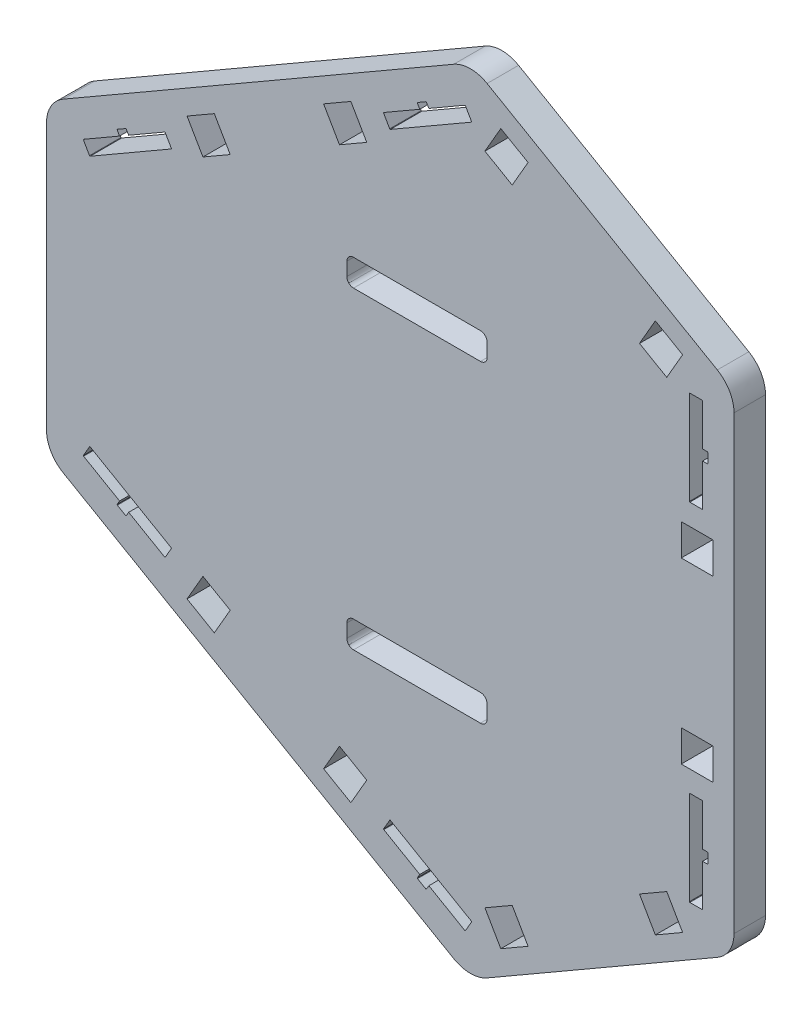
from build123d import *

# Parameters (mm, degrees)
MODEL_W                 = 6.05
MODEL_H                 = 6
SALIENTE_EXTRUIR1_DEPTH = 6


with BuildPart() as part:
    # Model → Saliente-Extruir1 (new body)
    with BuildSketch(Plane.XY):
        with BuildLine():
            add(Edge.make_bspline(
                [(107.007081542, 27.012297416), (108.972758542, 25.878034416), (111.391756542, 25.877070416), (113.357081542, 27.012297416)],
                knots=[0, 0, 0, 0, 1, 1, 1, 1], degree=3))
            Line((113.357081542, 27.012297416), (157.224997542, 52.339409416))
            add(Edge.make_bspline(
                [(157.224997542, 52.339409416), (159.190322542, 53.474613416), (160.400350542, 55.569231416), (160.399997542, 57.838721416)],
                knots=[0, 0, 0, 0, 1, 1, 1, 1], degree=3))
            Line((160.399997542, 57.838721416), (160.399997542, 143.764875416))
            add(Edge.make_bspline(
                [(160.399997542, 143.764875416), (160.399645542, 146.034294416), (159.190675542, 148.130147416), (157.224997542, 149.264327416)],
                knots=[0, 0, 0, 0, 1, 1, 1, 1], degree=3))
            Line((157.224997542, 149.264327416), (113.357081542, 174.591302416))
            add(Edge.make_bspline(
                [(113.357081542, 174.591302416), (111.391403542, 175.725483416), (108.972053542, 175.726541416), (107.007081542, 174.591302416)],
                knots=[0, 0, 0, 0, 1, 1, 1, 1], degree=3))
            Line((107.007081542, 174.591302416), (32.592792542, 131.628261416))
            add(Edge.make_bspline(
                [(32.592792542, 131.628261416), (30.627711542, 130.493022416), (29.417379542, 128.398227416), (29.417792542, 126.128808416)],
                knots=[0, 0, 0, 0, 1, 1, 1, 1], degree=3))
            Line((29.417792542, 126.128808416), (29.417792542, 75.474505416))
            add(Edge.make_bspline(
                [(29.417792542, 75.474505416), (29.418206542, 73.205086416), (30.627157542, 71.109586416), (32.592792542, 69.975405416)],
                knots=[0, 0, 0, 0, 1, 1, 1, 1], degree=3))
            Line((32.592792542, 69.975405416), (107.007081542, 27.012297416))
        make_face()
        Polygon((56.194090274, 60.967978309), (59.219111627, 66.207419674), (64.415251823, 63.207398497), (61.39023047, 57.967957133), align=None, mode=Mode.SUBTRACT)
        Polygon((87.405777131, 42.94796653), (82.209667177, 45.948040087), (85.234741347, 51.187450958), (90.430851301, 48.187377401), align=None, mode=Mode.SUBTRACT)
        with BuildLine():
            add(Edge.make_bspline(
                [(36.449514542, 74.710741416), (36.442741542, 74.736494416), (36.446339542, 74.763658416), (36.459568542, 74.786589416)],
                knots=[0, 0, 0, 0, 1, 1, 1, 1], degree=3))
            Line((36.459568542, 74.786589416), (37.609553542, 76.778372416))
            add(Edge.make_bspline(
                [(37.609553542, 76.778372416), (37.622783542, 76.801655416), (37.644690542, 76.818236416), (37.670161542, 76.824939416)],
                knots=[0, 0, 0, 0, 1, 1, 1, 1], degree=3))
            add(Edge.make_bspline(
                [(37.670161542, 76.824939416), (37.695808542, 76.831994416), (37.723218542, 76.828466416), (37.746114542, 76.815061416)],
                knots=[0, 0, 0, 0, 1, 1, 1, 1], degree=3))
            Line((37.746114542, 76.815061416), (53.161374542, 67.915183416))
            add(Edge.make_bspline(
                [(53.161374542, 67.915183416), (53.184410542, 67.902130416), (53.201061542, 67.880258416), (53.207976542, 67.854505416)],
                knots=[0, 0, 0, 0, 1, 1, 1, 1], degree=3))
            add(Edge.make_bspline(
                [(53.207976542, 67.854505416), (53.214855542, 67.829105416), (53.211292542, 67.801589416), (53.198063542, 67.778658416)],
                knots=[0, 0, 0, 0, 1, 1, 1, 1], degree=3))
            Line((53.198063542, 67.778658416), (52.048078542, 65.786875416))
            add(Edge.make_bspline(
                [(52.048078542, 65.786875416), (52.034848542, 65.763591416), (52.012941542, 65.747011416), (51.987294542, 65.740308416)],
                knots=[0, 0, 0, 0, 1, 1, 1, 1], degree=3))
            add(Edge.make_bspline(
                [(51.987294542, 65.740308416), (51.961823542, 65.733252416), (51.934377542, 65.736780416), (51.911376542, 65.750186416)],
                knots=[0, 0, 0, 0, 1, 1, 1, 1], degree=3))
            Line((51.911376542, 65.750186416), (45.069816542, 69.700239416))
            Line((45.069816542, 69.700239416), (44.619742542, 68.920952416))
            add(Edge.make_bspline(
                [(44.619742542, 68.920952416), (44.606654542, 68.897669416), (44.584746542, 68.881089416), (44.559135542, 68.874033416)],
                knots=[0, 0, 0, 0, 1, 1, 1, 1], degree=3))
            add(Edge.make_bspline(
                [(44.559135542, 68.874033416), (44.533488542, 68.867330416), (44.506218542, 68.870858416), (44.483182542, 68.884264416)],
                knots=[0, 0, 0, 0, 1, 1, 1, 1], degree=3))
            Line((44.483182542, 68.884264416), (42.924362542, 69.784200416))
            add(Edge.make_bspline(
                [(42.924362542, 69.784200416), (42.901467542, 69.797252416), (42.884675542, 69.819125416), (42.877796542, 69.844877416)],
                knots=[0, 0, 0, 0, 1, 1, 1, 1], degree=3))
            add(Edge.make_bspline(
                [(42.877796542, 69.844877416), (42.870881542, 69.870277416), (42.874480542, 69.897794416), (42.887709542, 69.920725416)],
                knots=[0, 0, 0, 0, 1, 1, 1, 1], degree=3))
            Line((42.887709542, 69.920725416), (43.337783542, 70.700011416))
            Line((43.337783542, 70.700011416), (36.496081542, 74.650064416))
            add(Edge.make_bspline(
                [(36.496081542, 74.650064416), (36.473221542, 74.663469416), (36.456393542, 74.684989416), (36.449514542, 74.710741416)],
                knots=[0, 0, 0, 0, 1, 1, 1, 1], degree=3))
        make_face(mode=Mode.SUBTRACT)
        with BuildLine():
            add(Edge.make_bspline(
                [(110.400450542, 34.834611416), (110.407153542, 34.808964416), (110.403625542, 34.781553416), (110.390220542, 34.758517416)],
                knots=[0, 0, 0, 0, 1, 1, 1, 1], degree=3))
            Line((110.390220542, 34.758517416), (109.240517542, 32.766698416))
            add(Edge.make_bspline(
                [(109.240517542, 32.766698416), (109.227111542, 32.743697416), (109.205239542, 32.727011416), (109.179839542, 32.720132416)],
                knots=[0, 0, 0, 0, 1, 1, 1, 1], degree=3))
            add(Edge.make_bspline(
                [(109.179839542, 32.720132416), (109.154086542, 32.713252416), (109.126570542, 32.716815416), (109.103639542, 32.730186416)],
                knots=[0, 0, 0, 0, 1, 1, 1, 1], degree=3))
            Line((109.103639542, 32.730186416), (102.262220542, 36.680203416))
            Line((102.262220542, 36.680203416), (101.812075542, 35.900776416))
            add(Edge.make_bspline(
                [(101.812075542, 35.900776416), (101.799022542, 35.877775416), (101.777150542, 35.860947416), (101.751397542, 35.854209416)],
                knots=[0, 0, 0, 0, 1, 1, 1, 1], degree=3))
            add(Edge.make_bspline(
                [(101.751397542, 35.854209416), (101.725997542, 35.847189416), (101.698481542, 35.850893416), (101.675550542, 35.864122416)],
                knots=[0, 0, 0, 0, 1, 1, 1, 1], degree=3))
            Line((101.675550542, 35.864122416), (100.116625542, 36.764129416))
            add(Edge.make_bspline(
                [(100.116625542, 36.764129416), (100.093695542, 36.777358416), (100.077114542, 36.799125416), (100.070058542, 36.824772416)],
                knots=[0, 0, 0, 0, 1, 1, 1, 1], degree=3))
            add(Edge.make_bspline(
                [(100.070058542, 36.824772416), (100.063356542, 36.850383416), (100.066883542, 36.877688416), (100.080289542, 36.900689416)],
                knots=[0, 0, 0, 0, 1, 1, 1, 1], degree=3))
            Line((100.080289542, 36.900689416), (100.530081542, 37.680117416))
            Line((100.530081542, 37.680117416), (93.688661542, 41.630099416))
            add(Edge.make_bspline(
                [(93.688661542, 41.630099416), (93.665378542, 41.643328416), (93.648797542, 41.665130416), (93.642095542, 41.690741416)],
                knots=[0, 0, 0, 0, 1, 1, 1, 1], degree=3))
            add(Edge.make_bspline(
                [(93.642095542, 41.690741416), (93.635039542, 41.716388416), (93.638567542, 41.743799416), (93.651972542, 41.766694416)],
                knots=[0, 0, 0, 0, 1, 1, 1, 1], degree=3))
            Line((93.651972542, 41.766694416), (94.802028542, 43.758478416))
            add(Edge.make_bspline(
                [(94.802028542, 43.758478416), (94.815081542, 43.781514416), (94.836953542, 43.798306416), (94.862353542, 43.805080416)],
                knots=[0, 0, 0, 0, 1, 1, 1, 1], degree=3))
            add(Edge.make_bspline(
                [(94.862353542, 43.805080416), (94.888106542, 43.812100416), (94.915622542, 43.808396416), (94.938553542, 43.795167416)],
                knots=[0, 0, 0, 0, 1, 1, 1, 1], degree=3))
            Line((94.938553542, 43.795167416), (110.353531542, 34.895077416))
            add(Edge.make_bspline(
                [(110.353531542, 34.895077416), (110.376814542, 34.881989416), (110.393395542, 34.860082416), (110.400450542, 34.834611416)],
                knots=[0, 0, 0, 0, 1, 1, 1, 1], degree=3))
        make_face(mode=Mode.SUBTRACT)
        Polygon((121.166681404, 36.139964959), (115.970526872, 33.139968611), (112.945530555, 38.37942443), (118.141685086, 41.379420778), align=None, mode=Mode.SUBTRACT)
        Polygon((142.390406233, 55.379403734), (147.586560764, 58.379400082), (150.611557081, 53.139944263), (145.41540255, 50.139947915), align=None, mode=Mode.SUBTRACT)
        with BuildLine():
            add(Edge.make_bspline(
                [(87.011989542, 68.787955416), (86.773511542, 69.025727416), (86.639808542, 69.350283416), (86.639456542, 69.686833416)],
                knots=[0, 0, 0, 0, 1, 1, 1, 1], degree=3))
            Line((86.639456542, 69.686833416), (86.639456542, 72.226833416))
            add(Edge.make_bspline(
                [(86.639456542, 72.226833416), (86.639456542, 72.563383416), (86.773158542, 72.886175416), (87.010931542, 73.124652416)],
                knots=[0, 0, 0, 0, 1, 1, 1, 1], degree=3))
            add(Edge.make_bspline(
                [(87.010931542, 73.124652416), (87.248703542, 73.362425416), (87.572906542, 73.496480416), (87.909456542, 73.496833416)],
                knots=[0, 0, 0, 0, 1, 1, 1, 1], degree=3))
            Line((87.909456542, 73.496833416), (112.090256542, 73.496833416))
            add(Edge.make_bspline(
                [(112.090256542, 73.496833416), (112.426806542, 73.496833416), (112.749950542, 73.363483416), (112.988075542, 73.125711416)],
                knots=[0, 0, 0, 0, 1, 1, 1, 1], degree=3))
            add(Edge.make_bspline(
                [(112.988075542, 73.125711416), (113.226200542, 72.887586416), (113.360256542, 72.563383416), (113.360256542, 72.226833416)],
                knots=[0, 0, 0, 0, 1, 1, 1, 1], degree=3))
            Line((113.360256542, 72.226833416), (113.360256542, 69.686833416))
            add(Edge.make_bspline(
                [(113.360256542, 69.686833416), (113.360608542, 69.350283416), (113.226906542, 69.027139416), (112.989133542, 68.789014416)],
                knots=[0, 0, 0, 0, 1, 1, 1, 1], degree=3))
            add(Edge.make_bspline(
                [(112.989133542, 68.789014416), (112.751361542, 68.550889416), (112.426806542, 68.416833416), (112.090256542, 68.416833416)],
                knots=[0, 0, 0, 0, 1, 1, 1, 1], degree=3))
            Line((112.090256542, 68.416833416), (87.909456542, 68.416833416))
            add(Edge.make_bspline(
                [(87.909456542, 68.416833416), (87.572906542, 68.416480416), (87.250114542, 68.550183416), (87.011989542, 68.787955416)],
                knots=[0, 0, 0, 0, 1, 1, 1, 1], degree=3))
        make_face(mode=Mode.SUBTRACT)
        with BuildLine():
            Line((155.400147941, 68.681688614), (155.40015183, 66.881463614))
            add(Edge.make_bspline(
                [(155.370870983, 66.81090855), (155.389568942, 66.829605591), (155.400151887, 66.855005614), (155.40015183, 66.881463614)],
                knots=[0, 0, 0, 0, 1, 1, 1, 1], degree=3))
            add(Edge.make_bspline(
                [(155.299963046, 66.781627397), (155.326421046, 66.781627454), (155.351821023, 66.792210509), (155.370870983, 66.81090855)],
                knots=[0, 0, 0, 0, 1, 1, 1, 1], degree=3))
            Line((155.299963046, 66.781627397), (154.400027046, 66.781625453))
            Line((154.400027046, 66.781625453), (154.400044115, 58.881519453))
            add(Edge.make_bspline(
                [(154.370763267, 58.810964389), (154.389461227, 58.82966143), (154.400044172, 58.855061453), (154.400044115, 58.881519453)],
                knots=[0, 0, 0, 0, 1, 1, 1, 1], degree=3))
            add(Edge.make_bspline(
                [(154.299855331, 58.781683236), (154.326666331, 58.781683294), (154.352066308, 58.792267349), (154.370763267, 58.810964389)],
                knots=[0, 0, 0, 0, 1, 1, 1, 1], degree=3))
            Line((154.299855331, 58.781683236), (152.000097331, 58.781678267))
            add(Edge.make_bspline(
                [(151.929188267, 58.810959114), (151.948238308, 58.792262155), (151.973638331, 58.78167821), (152.000097331, 58.781678267)],
                knots=[0, 0, 0, 0, 1, 1, 1, 1], degree=3))
            add(Edge.make_bspline(
                [(151.899908115, 58.881514051), (151.899908172, 58.855056051), (151.910491227, 58.829656074), (151.929188267, 58.810959114)],
                knots=[0, 0, 0, 0, 1, 1, 1, 1], degree=3))
            Line((151.899908115, 58.881514051), (151.899869656, 76.681623051))
            add(Edge.make_bspline(
                [(151.929149503, 76.752531114), (151.910452543, 76.733834074), (151.899869599, 76.708081051), (151.899869656, 76.681623051)],
                knots=[0, 0, 0, 0, 1, 1, 1, 1], degree=3))
            add(Edge.make_bspline(
                [(152.00005844, 76.781459267), (151.97359944, 76.78181221), (151.948199462, 76.771228155), (151.929149503, 76.752531114)],
                knots=[0, 0, 0, 0, 1, 1, 1, 1], degree=3))
            Line((152.00005844, 76.781459267), (154.29981644, 76.781464236))
            add(Edge.make_bspline(
                [(154.370724503, 76.752536389), (154.352027462, 76.771233349), (154.32662744, 76.781464294), (154.29981644, 76.781464236)],
                knots=[0, 0, 0, 0, 1, 1, 1, 1], degree=3))
            add(Edge.make_bspline(
                [(154.400005656, 76.681628453), (154.400005599, 76.708086453), (154.389422544, 76.73348643), (154.370724503, 76.752536389)],
                knots=[0, 0, 0, 0, 1, 1, 1, 1], degree=3))
            Line((154.400005656, 76.681628453), (154.400022725, 68.781522453))
            Line((154.400022725, 68.781522453), (155.299958725, 68.781524397))
            add(Edge.make_bspline(
                [(155.370866788, 68.75224455), (155.352169747, 68.77129451), (155.326416725, 68.781524454), (155.299958725, 68.781524397)],
                knots=[0, 0, 0, 0, 1, 1, 1, 1], degree=3))
            add(Edge.make_bspline(
                [(155.400147941, 68.681688614), (155.400147884, 68.708146614), (155.389564829, 68.733546591), (155.370866788, 68.75224455)],
                knots=[0, 0, 0, 0, 1, 1, 1, 1], degree=3))
        make_face(mode=Mode.SUBTRACT)
        with Locations((153.374997542, 83.801794095)):
            Rectangle(MODEL_W, MODEL_H, mode=Mode.SUBTRACT)
        with BuildLine():
            add(Edge.make_bspline(
                [(51.987153542, 135.863711416), (52.012800542, 135.856655416), (52.034707542, 135.840075416), (52.048078542, 135.817144416)],
                knots=[0, 0, 0, 0, 1, 1, 1, 1], degree=3))
            Line((52.048078542, 135.817144416), (53.198063542, 133.825361416))
            add(Edge.make_bspline(
                [(53.198063542, 133.825361416), (53.211292542, 133.802430416), (53.214855542, 133.774914416), (53.207976542, 133.749514416)],
                knots=[0, 0, 0, 0, 1, 1, 1, 1], degree=3))
            add(Edge.make_bspline(
                [(53.207976542, 133.749514416), (53.201202542, 133.723761416), (53.184269542, 133.701889416), (53.161374542, 133.688836416)],
                knots=[0, 0, 0, 0, 1, 1, 1, 1], degree=3))
            Line((53.161374542, 133.688836416), (37.746114542, 124.788605416))
            add(Edge.make_bspline(
                [(37.746114542, 124.788605416), (37.723218542, 124.775200416), (37.695949542, 124.771672416), (37.670302542, 124.778727416)],
                knots=[0, 0, 0, 0, 1, 1, 1, 1], degree=3))
            add(Edge.make_bspline(
                [(37.670302542, 124.778727416), (37.644690542, 124.785430416), (37.622783542, 124.802364416), (37.609553542, 124.825294416)],
                knots=[0, 0, 0, 0, 1, 1, 1, 1], degree=3))
            Line((37.609553542, 124.825294416), (36.459568542, 126.817077416))
            add(Edge.make_bspline(
                [(36.459568542, 126.817077416), (36.446339542, 126.840008416), (36.442741542, 126.867172416), (36.449514542, 126.892925416)],
                knots=[0, 0, 0, 0, 1, 1, 1, 1], degree=3))
            add(Edge.make_bspline(
                [(36.449514542, 126.892925416), (36.456393542, 126.918677416), (36.473221542, 126.940550416), (36.496081542, 126.953602416)],
                knots=[0, 0, 0, 0, 1, 1, 1, 1], degree=3))
            Line((36.496081542, 126.953602416), (43.337783542, 130.903655416))
            Line((43.337783542, 130.903655416), (42.887709542, 131.683294416))
            add(Edge.make_bspline(
                [(42.887709542, 131.683294416), (42.874480542, 131.705872416), (42.870881542, 131.733389416), (42.877796542, 131.758789416)],
                knots=[0, 0, 0, 0, 1, 1, 1, 1], degree=3))
            add(Edge.make_bspline(
                [(42.877796542, 131.758789416), (42.884675542, 131.784541416), (42.901467542, 131.806414416), (42.924362542, 131.819819416)],
                knots=[0, 0, 0, 0, 1, 1, 1, 1], degree=3))
            Line((42.924362542, 131.819819416), (44.483182542, 132.719755416))
            add(Edge.make_bspline(
                [(44.483182542, 132.719755416), (44.506077542, 132.732808416), (44.533347542, 132.736336416), (44.558993542, 132.729633416)],
                knots=[0, 0, 0, 0, 1, 1, 1, 1], degree=3))
            add(Edge.make_bspline(
                [(44.558993542, 132.729633416), (44.584605542, 132.722930416), (44.606513542, 132.705997416), (44.619742542, 132.683066416)],
                knots=[0, 0, 0, 0, 1, 1, 1, 1], degree=3))
            Line((44.619742542, 132.683066416), (45.069816542, 131.903780416))
            Line((45.069816542, 131.903780416), (51.911376542, 135.853480416))
            add(Edge.make_bspline(
                [(51.911376542, 135.853480416), (51.934377542, 135.866886416), (51.961682542, 135.870414416), (51.987153542, 135.863711416)],
                knots=[0, 0, 0, 0, 1, 1, 1, 1], degree=3))
        make_face(mode=Mode.SUBTRACT)
        Polygon((64.415170597, 138.395990951), (59.219036883, 135.395958547), (56.194004209, 140.635393376), (61.390137924, 143.635425779), align=None, mode=Mode.SUBTRACT)
        Polygon((85.234634151, 150.415983473), (82.20954866, 155.655387808), (87.405652132, 158.655472591), (90.430737623, 153.416068256), align=None, mode=Mode.SUBTRACT)
        with BuildLine():
            add(Edge.make_bspline(
                [(87.011989542, 128.478308416), (86.773511542, 128.716080416), (86.639808542, 129.040283416), (86.639456542, 129.377186416)],
                knots=[0, 0, 0, 0, 1, 1, 1, 1], degree=3))
            Line((86.639456542, 129.377186416), (86.639456542, 131.917186416))
            add(Edge.make_bspline(
                [(86.639456542, 131.917186416), (86.639456542, 132.253736416), (86.773158542, 132.576527416), (87.010931542, 132.814652416)],
                knots=[0, 0, 0, 0, 1, 1, 1, 1], degree=3))
            add(Edge.make_bspline(
                [(87.010931542, 132.814652416), (87.248703542, 133.052777416), (87.572906542, 133.186833416), (87.909456542, 133.187186416)],
                knots=[0, 0, 0, 0, 1, 1, 1, 1], degree=3))
            Line((87.909456542, 133.187186416), (112.090256542, 133.187186416))
            add(Edge.make_bspline(
                [(112.090256542, 133.187186416), (112.426806542, 133.187539416), (112.749950542, 133.053836416), (112.988075542, 132.816064416)],
                knots=[0, 0, 0, 0, 1, 1, 1, 1], degree=3))
            add(Edge.make_bspline(
                [(112.988075542, 132.816064416), (113.226200542, 132.577939416), (113.360256542, 132.253736416), (113.360256542, 131.917186416)],
                knots=[0, 0, 0, 0, 1, 1, 1, 1], degree=3))
            Line((113.360256542, 131.917186416), (113.360256542, 129.377186416))
            add(Edge.make_bspline(
                [(113.360256542, 129.377186416), (113.360608542, 129.040283416), (113.226906542, 128.717491416), (112.989133542, 128.479366416)],
                knots=[0, 0, 0, 0, 1, 1, 1, 1], degree=3))
            add(Edge.make_bspline(
                [(112.989133542, 128.479366416), (112.751361542, 128.241241416), (112.426806542, 128.107539416), (112.090256542, 128.107186416)],
                knots=[0, 0, 0, 0, 1, 1, 1, 1], degree=3))
            Line((112.090256542, 128.107186416), (87.909456542, 128.107186416))
            add(Edge.make_bspline(
                [(87.909456542, 128.107186416), (87.572906542, 128.106833416), (87.250114542, 128.240536416), (87.011989542, 128.478308416)],
                knots=[0, 0, 0, 0, 1, 1, 1, 1], degree=3))
        make_face(mode=Mode.SUBTRACT)
        Polygon((150.349997542, 114.801787559), (150.349997542, 120.801794095), (156.399997542, 120.801794095), (156.399997542, 114.801794095), align=None, mode=Mode.SUBTRACT)
        with BuildLine():
            add(Edge.make_bspline(
                [(155.370797542, 134.792677416), (155.389495542, 134.773980416), (155.400078542, 134.748580416), (155.400078542, 134.722122416)],
                knots=[0, 0, 0, 0, 1, 1, 1, 1], degree=3))
            Line((155.400078542, 134.722122416), (155.400078542, 132.921897416))
            add(Edge.make_bspline(
                [(155.400078542, 132.921897416), (155.400078542, 132.895439416), (155.389495542, 132.870039416), (155.370797542, 132.851341416)],
                knots=[0, 0, 0, 0, 1, 1, 1, 1], degree=3))
            add(Edge.make_bspline(
                [(155.370797542, 132.851341416), (155.352100542, 132.832291416), (155.326347542, 132.822061416), (155.299889542, 132.822061416)],
                knots=[0, 0, 0, 0, 1, 1, 1, 1], degree=3))
            Line((155.299889542, 132.822061416), (154.399953542, 132.822061416))
            Line((154.399953542, 132.822061416), (154.399953542, 124.921955416))
            add(Edge.make_bspline(
                [(154.399953542, 124.921955416), (154.399953542, 124.895497416), (154.389370542, 124.870097416), (154.370672542, 124.851047416)],
                knots=[0, 0, 0, 0, 1, 1, 1, 1], degree=3))
            add(Edge.make_bspline(
                [(154.370672542, 124.851047416), (154.351975542, 124.832350416), (154.326575542, 124.822119416), (154.299764542, 124.822119416)],
                knots=[0, 0, 0, 0, 1, 1, 1, 1], degree=3))
            Line((154.299764542, 124.822119416), (152.000006542, 124.822119416))
            add(Edge.make_bspline(
                [(152.000006542, 124.822119416), (151.973547542, 124.821766416), (151.948147542, 124.832350416), (151.929097542, 124.851047416)],
                knots=[0, 0, 0, 0, 1, 1, 1, 1], degree=3))
            add(Edge.make_bspline(
                [(151.929097542, 124.851047416), (151.910400542, 124.869744416), (151.899817542, 124.895497416), (151.899817542, 124.921955416)],
                knots=[0, 0, 0, 0, 1, 1, 1, 1], degree=3))
            Line((151.899817542, 124.921955416), (151.899817542, 142.722064416))
            add(Edge.make_bspline(
                [(151.899817542, 142.722064416), (151.899817542, 142.748522416), (151.910400542, 142.773922416), (151.929097542, 142.792619416)],
                knots=[0, 0, 0, 0, 1, 1, 1, 1], degree=3))
            add(Edge.make_bspline(
                [(151.929097542, 142.792619416), (151.948147542, 142.811316416), (151.973547542, 142.821900416), (152.000006542, 142.821900416)],
                knots=[0, 0, 0, 0, 1, 1, 1, 1], degree=3))
            Line((152.000006542, 142.821900416), (154.299764542, 142.821900416))
            add(Edge.make_bspline(
                [(154.299764542, 142.821900416), (154.326575542, 142.821900416), (154.351975542, 142.811316416), (154.370672542, 142.792619416)],
                knots=[0, 0, 0, 0, 1, 1, 1, 1], degree=3))
            add(Edge.make_bspline(
                [(154.370672542, 142.792619416), (154.389370542, 142.773922416), (154.399953542, 142.748522416), (154.399953542, 142.722064416)],
                knots=[0, 0, 0, 0, 1, 1, 1, 1], degree=3))
            Line((154.399953542, 142.722064416), (154.399953542, 134.821958416))
            Line((154.399953542, 134.821958416), (155.299889542, 134.821958416))
            add(Edge.make_bspline(
                [(155.299889542, 134.821958416), (155.326347542, 134.821958416), (155.351747542, 134.811375416), (155.370797542, 134.792677416)],
                knots=[0, 0, 0, 0, 1, 1, 1, 1], degree=3))
        make_face(mode=Mode.SUBTRACT)
        with BuildLine():
            Line((109.240370546, 168.836787881), (110.390077849, 166.844971365))
            add(Edge.make_bspline(
                [(110.400308014, 166.768877387), (110.407010958, 166.794524402), (110.403482899, 166.821935394), (110.390077849, 166.844971365)],
                knots=[0, 0, 0, 0, 1, 1, 1, 1], degree=3))
            add(Edge.make_bspline(
                [(110.353389144, 166.708411286), (110.376672116, 166.721499336), (110.393253069, 166.743406372), (110.400308014, 166.768877387)],
                knots=[0, 0, 0, 0, 1, 1, 1, 1], degree=3))
            Line((110.353389144, 166.708411286), (94.938430374, 157.80828798))
            add(Edge.make_bspline(
                [(94.862230395, 157.798374816), (94.88798341, 157.791354871), (94.915499402, 157.795058931), (94.938430374, 157.80828798)],
                knots=[0, 0, 0, 0, 1, 1, 1, 1], degree=3))
            add(Edge.make_bspline(
                [(94.801905294, 157.844976685), (94.814958344, 157.821940713), (94.836830381, 157.805148761), (94.862230395, 157.798374816)],
                knots=[0, 0, 0, 0, 1, 1, 1, 1], degree=3))
            Line((94.801905294, 157.844976685), (93.651844991, 159.8367582))
            add(Edge.make_bspline(
                [(93.641967827, 159.912711179), (93.634911882, 159.887064164), (93.638439942, 159.859653171), (93.651844991, 159.8367582)],
                knots=[0, 0, 0, 0, 1, 1, 1, 1], degree=3))
            add(Edge.make_bspline(
                [(93.688533696, 159.97335328), (93.665250724, 159.960124229), (93.648669772, 159.938322194), (93.641967827, 159.912711179)],
                knots=[0, 0, 0, 0, 1, 1, 1, 1], degree=3))
            Line((93.688533696, 159.97335328), (100.529945162, 163.923350061))
            Line((100.529945162, 163.923350061), (100.080151478, 164.702777089))
            add(Edge.make_bspline(
                [(100.069920314, 164.778694067), (100.063218369, 164.753083053), (100.066745428, 164.72577806), (100.080151478, 164.702777089)],
                knots=[0, 0, 0, 0, 1, 1, 1, 1], degree=3))
            add(Edge.make_bspline(
                [(100.116487182, 164.839337168), (100.093557211, 164.826108118), (100.076976258, 164.804341083), (100.069920314, 164.778694067)],
                knots=[0, 0, 0, 0, 1, 1, 1, 1], degree=3))
            Line((100.116487182, 164.839337168), (101.675410238, 165.739347536))
            add(Edge.make_bspline(
                [(101.751257217, 165.7492607), (101.725857201, 165.756280645), (101.698341209, 165.752576586), (101.675410238, 165.739347536)],
                knots=[0, 0, 0, 0, 1, 1, 1, 1], degree=3))
            add(Edge.make_bspline(
                [(101.811935317, 165.702693831), (101.798882267, 165.725694803), (101.777010231, 165.742522756), (101.751257217, 165.7492607)],
                knots=[0, 0, 0, 0, 1, 1, 1, 1], degree=3))
            Line((101.811935317, 165.702693831), (102.262082001, 164.923267804))
            Line((102.262082001, 164.923267804), (109.103492467, 168.873299585))
            add(Edge.make_bspline(
                [(109.179692445, 168.88335375), (109.15393943, 168.890233694), (109.126423438, 168.886670635), (109.103492467, 168.873299585)],
                knots=[0, 0, 0, 0, 1, 1, 1, 1], degree=3))
            add(Edge.make_bspline(
                [(109.240370546, 168.836787881), (109.226964496, 168.859788852), (109.20509246, 168.876474805), (109.179692445, 168.88335375)],
                knots=[0, 0, 0, 0, 1, 1, 1, 1], degree=3))
        make_face(mode=Mode.SUBTRACT)
        Polygon((118.141556699, 160.224084751), (112.945395686, 163.224069872), (115.970380683, 168.463532227), (121.166541696, 165.463547106), align=None, mode=Mode.SUBTRACT)
        Polygon((150.611454103, 148.463631421), (147.586469106, 143.224169066), (142.390308093, 146.224154187), (145.41529309, 151.463616541), align=None, mode=Mode.SUBTRACT)
    extrude(amount=SALIENTE_EXTRUIR1_DEPTH)


solid = part.part
